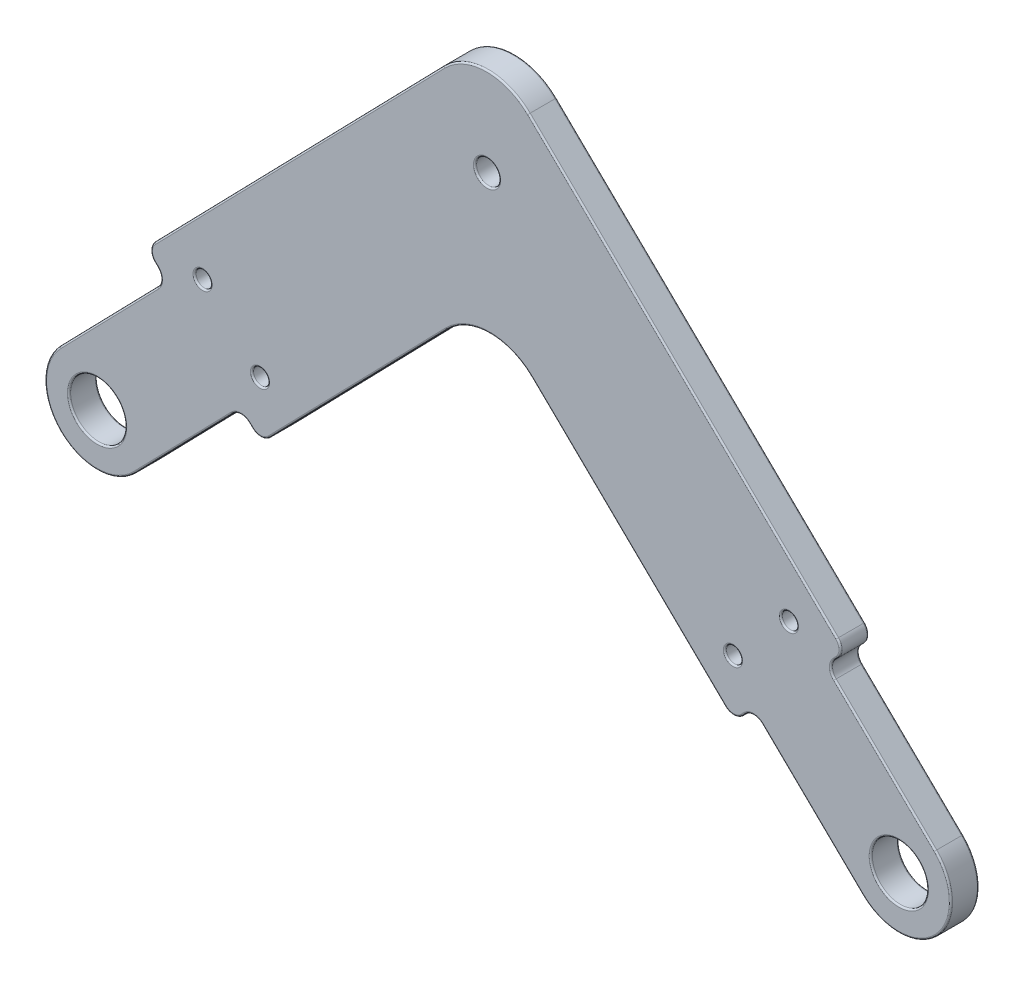
from build123d import *

# Parameters (mm, degrees)
SKETCH4_R           = 3.5
SKETCH4_R_2         = 1
BOSS_EXTRUDE1_DEPTH = 3.5
SKETCH6_R           = 1.5
CUT_EXTRUDE1_DEPTH  = 3.5
FILLET1_R           = 7.5
FILLET2_R           = 1.5
FILLET3_R           = 0.2


with BuildPart() as part:
    # Sketch4 → Boss-Extrude1 (new body)
    with BuildSketch(Plane.XY):
        with BuildLine():
            Line((-79.582445844, 6.642550886), (-51.168783294, 35.840639702))
            Line((-51.168783294, 35.840639702), (-20.590838093, 6.084191536))
            Line((-20.590838093, 6.084191536), (-18.149887831, 8.592529995))
            Line((-18.149887831, 8.592529995), (-4.533193342, -4.658342852))
            ThreePointArc((-4.533193342, -4.658342852), (4.658342852, -4.533193342), (4.533193342, 4.658342852))
            Line((4.533193342, 4.658342852), (-9.083501147, 17.909215698))
            Line((-9.083501147, 17.909215698), (-6.642550886, 20.417554156))
            Line((-6.642550886, 20.417554156), (-51.553858708, 64.122289529))
            Line((-51.553858708, 64.122289529), (-93.915808464, 20.590838093))
            Line((-93.915808464, 20.590838093), (-91.407470005, 18.149887831))
            Line((-91.407470005, 18.149887831), (-104.658342852, 4.533193342))
            ThreePointArc((-104.658342852, 4.533193342), (-104.533193342, -4.658342852), (-95.341657148, -4.533193342))
            Line((-95.341657148, -4.533193342), (-82.090784302, 9.083501147))
            Line((-82.090784302, 9.083501147), (-79.582445844, 6.642550886))
        make_face()
        Circle(SKETCH4_R, mode=Mode.SUBTRACT)
        with Locations((-100, 0)):
            Circle(SKETCH4_R, mode=Mode.SUBTRACT)
        with Locations((-86.845396007, 20.687106946)):
            Circle(SKETCH4_R_2, mode=Mode.SUBTRACT)
        with Locations((-79.678714697, 13.712963343)):
            Circle(SKETCH4_R_2, mode=Mode.SUBTRACT)
        with Locations((-20.687106946, 13.154603993)):
            Circle(SKETCH4_R_2, mode=Mode.SUBTRACT)
        with Locations((-13.712963343, 20.321285303)):
            Circle(SKETCH4_R_2, mode=Mode.SUBTRACT)
    extrude(amount=BOSS_EXTRUDE1_DEPTH)

    # Sketch6 → Cut-Extrude1 (cut)
    with BuildSketch(Plane.XY.offset(3.5)):
        with Locations((-51.361321001, 49.981464616)):
            Circle(SKETCH6_R)
    extrude(amount=-CUT_EXTRUDE1_DEPTH, mode=Mode.SUBTRACT)

    # Fillet1
    fillet1_edges = [part.edges().sort_by_distance(p)[0] for p in [
        (-51.553858708, 64.122289529, 1.75),
        (-51.168783294, 35.840639702, 1.75),
    ]]
    fillet(fillet1_edges, radius=FILLET1_R)

    # Fillet2
    fillet2_edges = [part.edges().sort_by_distance(p)[0] for p in [
        (-82.090784302, 9.083501147, 1.75),
        (-91.407470005, 18.149887831, 1.75),
        (-93.915808464, 20.590838093, 1.75),
        (-6.642550886, 20.417554156, 1.75),
        (-9.083501147, 17.909215698, 1.75),
        (-18.149887831, 8.592529995, 1.75),
        (-20.590838093, 6.084191536, 1.75),
        (-79.582445844, 6.642550886, 1.75),
    ]]
    fillet(fillet2_edges, radius=FILLET2_R)

    # Fillet3
    fillet3_edges = [part.edges().sort_by_distance(p)[0] for p in [
        (-67.46785765, 19.091590901, 3.5),
        (-19.370362962, 7.338360765, 3.5),
        (-10.804039488, 1.444032801, 3.5),
        (-93.294545705, 20.599297041, 3.5),
        (-79.590904792, 7.263813645, 3.5),
        (-20.599297041, 6.705454295, 3.5),
        (-7.263813645, 20.409095208, 3.5),
        (-8.462238388, 17.917674646, 0),
        (-8.462238388, 17.917674646, 3.5),
        (-18.141428883, 7.971267236, 0),
        (-18.141428883, 7.971267236, 3.5),
        (-82.082325354, 8.462238388, 0),
        (-82.082325354, 8.462238388, 3.5),
        (-92.028732764, 18.141428883, 0),
        (-92.028732764, 18.141428883, 3.5),
        (-89.239281496, 1.737652804, 0),
        (-104.533193342, -4.658342852, 0),
        (-1.737652804, 10.760718504, 0),
        (4.658342852, -4.533193342, 0),
        (4.658342852, -4.533193342, 3.5),
        (-1.737652804, 10.760718504, 3.5),
        (-3.5, 0, 0),
        (-3.5, 0, 3.5),
        (-103.5, 0, 0),
        (-103.5, 0, 3.5),
        (-87.845396007, 20.687106946, 0),
        (-87.845396007, 20.687106946, 3.5),
        (-80.678714697, 13.712963343, 0),
        (-80.678714697, 13.712963343, 3.5),
        (-21.687106946, 13.154603993, 0),
        (-21.687106946, 13.154603993, 3.5),
        (-104.533193342, -4.658342852, 3.5),
        (-14.712963343, 20.321285303, 0),
        (-14.712963343, 20.321285303, 3.5),
        (-89.239281496, 1.737652804, 3.5),
        (-52.861321001, 49.981464616, 0),
        (-52.861321001, 49.981464616, 3.5),
        (-33.7298063, 18.870172538, 0),
        (-33.7298063, 18.870172538, 3.5),
        (-74.827076667, 40.206559418, 0),
        (-74.827076667, 40.206559418, 3.5),
        (-51.511563966, 61.015975735, 0),
        (-51.511563966, 61.015975735, 3.5),
        (-51.126488552, 32.734325908, 0),
        (-51.126488552, 32.734325908, 3.5),
        (-26.948200404, 40.177678762, 0),
        (-26.948200404, 40.177678762, 3.5),
        (-7.863026017, 19.163384927, 0),
        (-10.804039488, 1.444032801, 0),
        (-19.370362962, 7.338360765, 0),
        (-67.46785765, 19.091590901, 0),
        (-80.836615073, 7.863026017, 0),
        (-98.555967199, 10.804039488, 0),
        (-92.661639235, 19.370362962, 0),
        (-93.294545705, 20.599297041, 0),
        (-79.590904792, 7.263813645, 0),
        (-20.599297041, 6.705454295, 0),
        (-7.263813645, 20.409095208, 0),
        (-7.863026017, 19.163384927, 3.5),
        (-92.661639235, 19.370362962, 3.5),
        (-98.555967199, 10.804039488, 3.5),
        (-80.836615073, 7.863026017, 3.5),
    ]]
    fillet(fillet3_edges, radius=FILLET3_R)


solid = part.part
